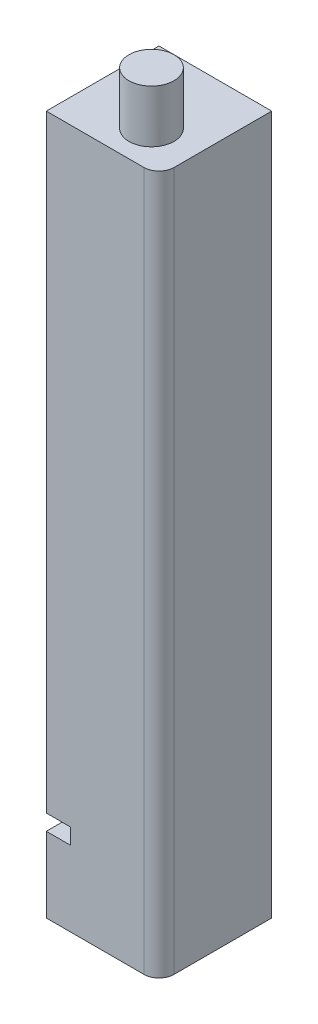
from build123d import *

# Parameters (mm, degrees)
SKETCH1_W           = 15
SKETCH1_H           = 15
BOSS_EXTRUDE1_DEPTH = 93
SKETCH2_R           = 3
BOSS_EXTRUDE2_DEPTH = 7
SKETCH3_W           = 3.2
SKETCH3_H           = 2.1
CUT_EXTRUDE1_DEPTH  = 102.396498953
FILLET1_R           = 2


with BuildPart() as part:
    # Sketch1 → Boss-Extrude1 (new body)
    with BuildSketch(Plane(origin=(0, 0, 0), x_dir=(1, 0, 0), z_dir=(0, 1, 0))):
        Rectangle(SKETCH1_W, SKETCH1_H)
    extrude(amount=BOSS_EXTRUDE1_DEPTH)

    # Sketch2 → Boss-Extrude2 (add)
    with BuildSketch(Plane(origin=(0, 93, 0), x_dir=(1, 0, 0), z_dir=(0, 1, 0))):
        with Locations(Location((1.5, -2.5, 0), (0, 0, 90))):
            Circle(SKETCH2_R)
    extrude(amount=BOSS_EXTRUDE2_DEPTH)

    # Sketch3 → Cut-Extrude1 (cut, through all)
    with BuildSketch(Plane.XY.offset(7.5)):
        with Locations((-5.9, 11.05)):
            Rectangle(SKETCH3_W, SKETCH3_H)
    extrude(amount=-CUT_EXTRUDE1_DEPTH, mode=Mode.SUBTRACT)

    # Fillet1
    fillet1_edges = [part.edges().sort_by_distance(p)[0] for p in [
        (7.5, 46.5, 7.5),
    ]]
    fillet(fillet1_edges, radius=FILLET1_R)


solid = part.part
